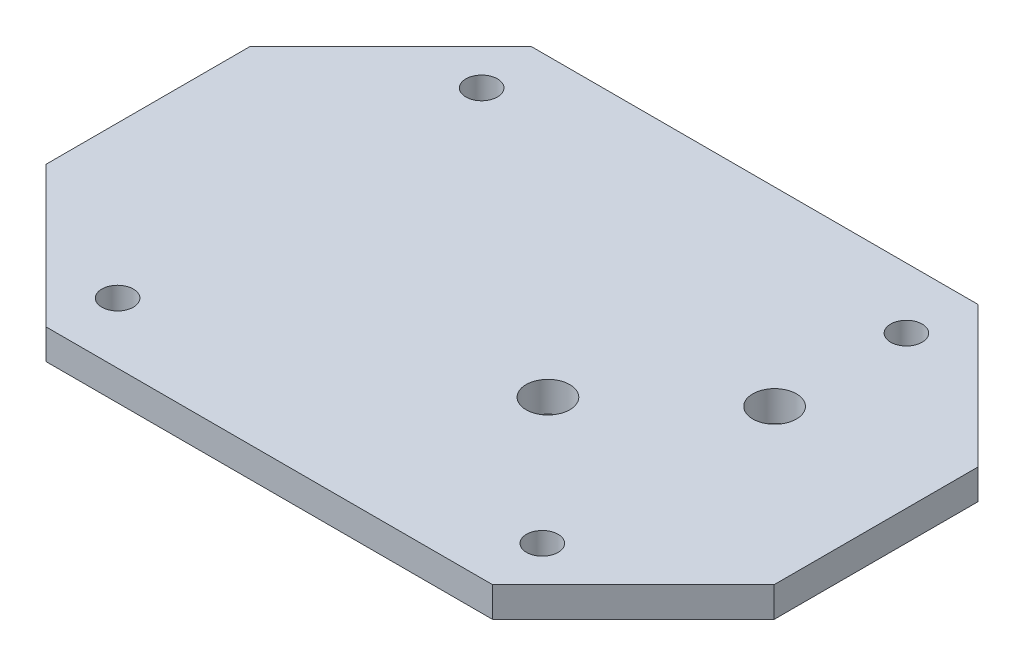
from build123d import *

# Parameters (mm, degrees)
SKETCH1_R           = 1.651
SKETCH1_R_2         = 2.286
BOSS_EXTRUDE1_DEPTH = 3.1496


with BuildPart() as part:
    # Sketch1 → Boss-Extrude1 (new body)
    with BuildSketch(Plane(origin=(0, 0, 0), x_dir=(1, 0, 0), z_dir=(0, 1, 0))):
        Polygon((23.368, -25.4), (38.1, -10.668), (38.1, 10.668), (23.368, 25.4), (-23.368, 25.4), (-38.1, 10.668), (-38.1, -10.668), (-23.368, -25.4), align=None)
        with Locations(Location((-22.225, 19.05, 0), (0, 0, 270))):
            Circle(SKETCH1_R, mode=Mode.SUBTRACT)
        with Locations(Location((22.225, 19.05, 0), (0, 0, 270))):
            Circle(SKETCH1_R, mode=Mode.SUBTRACT)
        with Locations(Location((22.225, -19.05, 0), (0, 0, 270))):
            Circle(SKETCH1_R, mode=Mode.SUBTRACT)
        with Locations(Location((-22.225, -19.05, 0), (0, 0, 270))):
            Circle(SKETCH1_R, mode=Mode.SUBTRACT)
        with Locations(Location((9.271, -5.5118, 0), (0, 0, 270))):
            Circle(SKETCH1_R_2, mode=Mode.SUBTRACT)
        with Locations(Location((21.971, 5.5118, 0), (0, 0, 270))):
            Circle(SKETCH1_R_2, mode=Mode.SUBTRACT)
    extrude(amount=BOSS_EXTRUDE1_DEPTH)


solid = part.part
